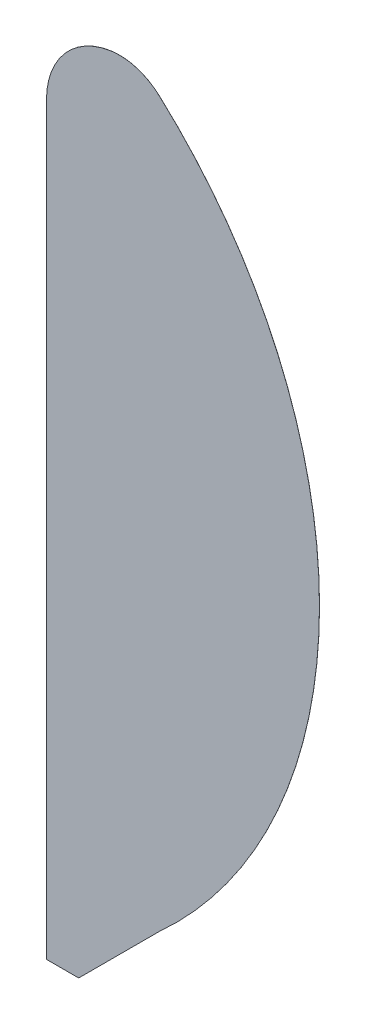
from build123d import *

# Parameters (mm, degrees)
BOSS_EXTRUDE1_DEPTH = 0.01


with BuildPart() as part:
    # Sketch1 → Boss-Extrude1 (new body)
    with BuildSketch(Plane(origin=(0, 0, 0), x_dir=(0, 1, 0), z_dir=(0, 0, 1))):
        with BuildLine():
            Line((0, 0), (115.443, 0))
            ThreePointArc((115.443, 0), (123.084404468, -2.847041306), (127, -10))
            ThreePointArc((127, -10), (126.694126065, -14.006745363), (124.707989286, -17.5))
            ThreePointArc((124.707989286, -17.5), (68.603994643, -42.333333333), (12.5, -17.5))
            Line((12.5, -17.5), (0, -5))
            Line((0, -5), (0, 0))
        make_face()
    extrude(amount=BOSS_EXTRUDE1_DEPTH)


solid = part.part
